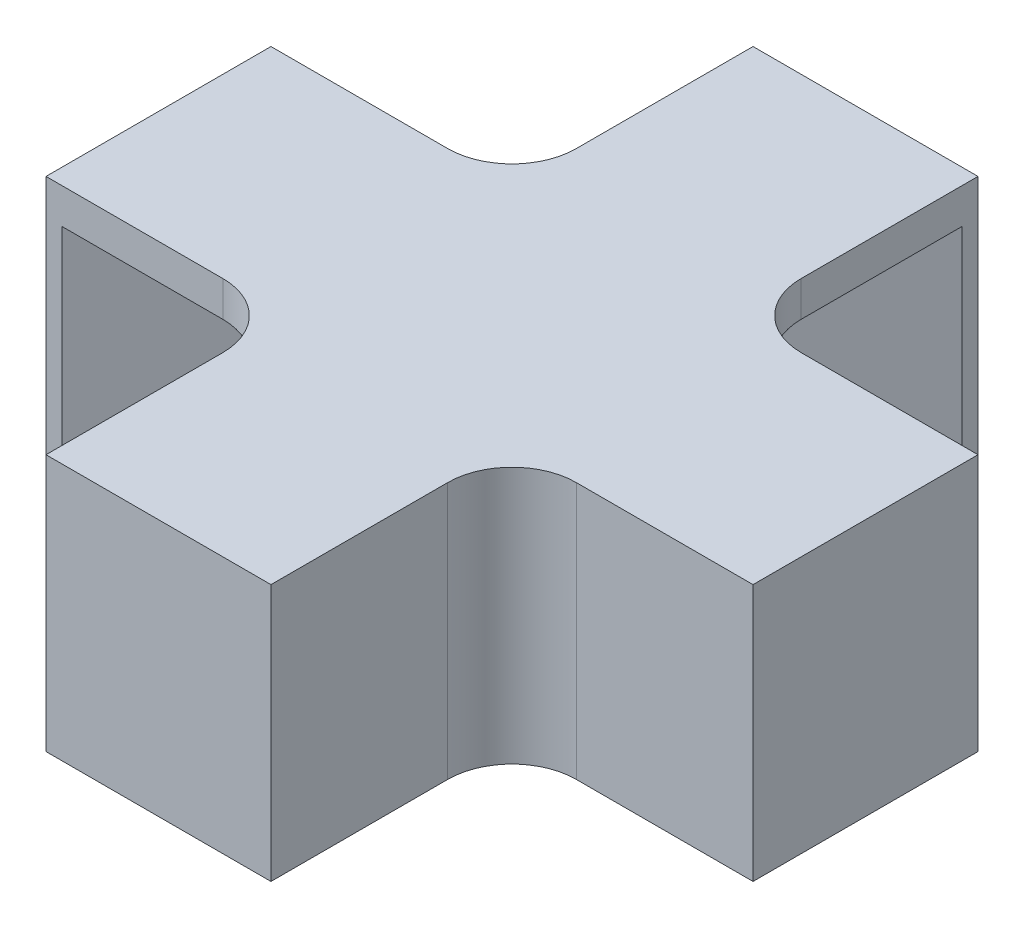
from build123d import *

# Parameters (mm, degrees)
BOSS_EXTRUDE6_DEPTH = 40
CUT_EXTRUDE2_DEPTH  = 34.5


with BuildPart() as part:
    # Sketch1 → Boss-Extrude6 (new body)
    with BuildSketch(Plane(origin=(0, 0, 0), x_dir=(1, 0, 0), z_dir=(0, 1, 0))):
        with BuildLine():
            Line((-35.196356555, 67.823627432), (-70.196356555, 67.823627432))
            Line((-70.196356555, 67.823627432), (-70.196356555, 40.323627432))
            ThreePointArc((-70.196356555, 40.323627432), (-73.125288743, 33.25255962), (-80.196356555, 30.323627432))
            Line((-80.196356555, 30.323627432), (-107.696356555, 30.323627432))
            Line((-107.696356555, 30.323627432), (-107.696356555, -4.676372568))
            Line((-107.696356555, -4.676372568), (-80.196356555, -4.676372568))
            ThreePointArc((-80.196356555, -4.676372568), (-73.125288743, -7.605304756), (-70.196356555, -14.676372568))
            Line((-70.196356555, -14.676372568), (-70.196356555, -42.176372568))
            Line((-70.196356555, -42.176372568), (-35.196356555, -42.176372568))
            Line((-35.196356555, -42.176372568), (-35.196356555, -14.676372568))
            ThreePointArc((-35.196356555, -14.676372568), (-32.267424367, -7.605304756), (-25.196356555, -4.676372568))
            Line((-25.196356555, -4.676372568), (2.303643445, -4.676372568))
            Line((2.303643445, -4.676372568), (2.303643445, 30.323627432))
            Line((2.303643445, 30.323627432), (-25.196356555, 30.323627432))
            ThreePointArc((-25.196356555, 30.323627432), (-32.267424367, 33.25255962), (-35.196356555, 40.323627432))
            Line((-35.196356555, 40.323627432), (-35.196356555, 67.823627432))
        make_face()
        Polygon((-35.196356555, -4.676372568), (-35.194570886, -4.676372568), (-35.196356555, -4.678158237), align=None, mode=Mode.SUBTRACT)
    extrude(amount=BOSS_EXTRUDE6_DEPTH)

    # Sketch1<9> → Cut-Extrude2 (cut)
    with BuildSketch(Plane(origin=(0, 0, 0), x_dir=(1, 0, 0), z_dir=(0, 1, 0))):
        Polygon((-35.196356555, 50.831509755), (-35.196356555, 65.325413101), (-70.196356555, 30.325413101), (-105.198142224, -4.676372568), (-90.704238878, -4.676372568), (-70.196356555, -25.184254891), (-70.196356555, -39.678158237), (-35.196356555, -4.678158237), (-35.196356555, -4.676372568), (-35.194570886, -4.676372568), (-0.194570886, 30.323627432), (-14.688474232, 30.323627432), align=None)
    extrude(amount=CUT_EXTRUDE2_DEPTH, mode=Mode.SUBTRACT)


solid = part.part
